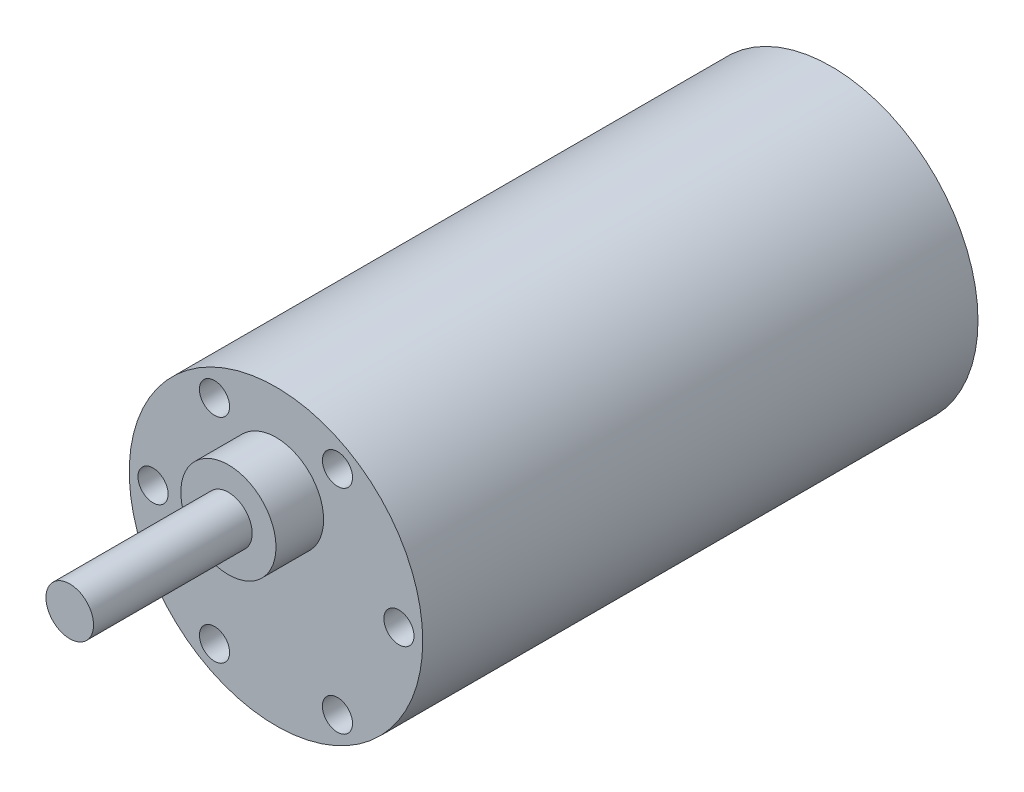
from build123d import *

# Parameters (mm, degrees)
SKETCH1_R           = 18.5
BOSS_EXTRUDE1_DEPTH = 70
SKETCH2_R           = 1.9
CUT_EXTRUDE1_DEPTH  = 3
SKETCH2_3_R         = 6
BOSS_EXTRUDE2_DEPTH = 6
SKETCH3_R           = 3
BOSS_EXTRUDE3_DEPTH = 20


with BuildPart() as part:
    # Sketch1 → Boss-Extrude1 (new body)
    with BuildSketch(Plane(origin=(0, 0, 0), x_dir=(0, 1, 0), z_dir=(0, 0, 1))):
        Circle(SKETCH1_R)
    extrude(amount=BOSS_EXTRUDE1_DEPTH)

    # Sketch2 → Cut-Extrude1 (cut)
    with BuildSketch(Plane(origin=(0, 0, 70), x_dir=(-1, 0, 0), z_dir=(0, 0, 1))):
        with Locations((-15.5, 0)):
            Circle(SKETCH2_R)
        with Locations((-7.75, 13.423393759)):
            Circle(SKETCH2_R)
        with Locations((7.75, 13.423393759)):
            Circle(SKETCH2_R)
        with Locations((15.5, 0)):
            Circle(SKETCH2_R)
        with Locations((7.75, -13.423393759)):
            Circle(SKETCH2_R)
        with Locations((-7.75, -13.423393759)):
            Circle(SKETCH2_R)
    extrude(amount=-CUT_EXTRUDE1_DEPTH, mode=Mode.SUBTRACT)

    # Sketch2<3> → Boss-Extrude2 (add)
    with BuildSketch(Plane(origin=(0, 0, 70), x_dir=(-1, 0, 0), z_dir=(0, 0, 1))):
        with Locations((0, -7)):
            Circle(SKETCH2_3_R)
    extrude(amount=BOSS_EXTRUDE2_DEPTH)

    # Sketch3 → Boss-Extrude3 (add)
    with BuildSketch(Plane.XY.offset(76)):
        with Locations((0, 7)):
            Circle(SKETCH3_R)
    extrude(amount=BOSS_EXTRUDE3_DEPTH)


solid = part.part
